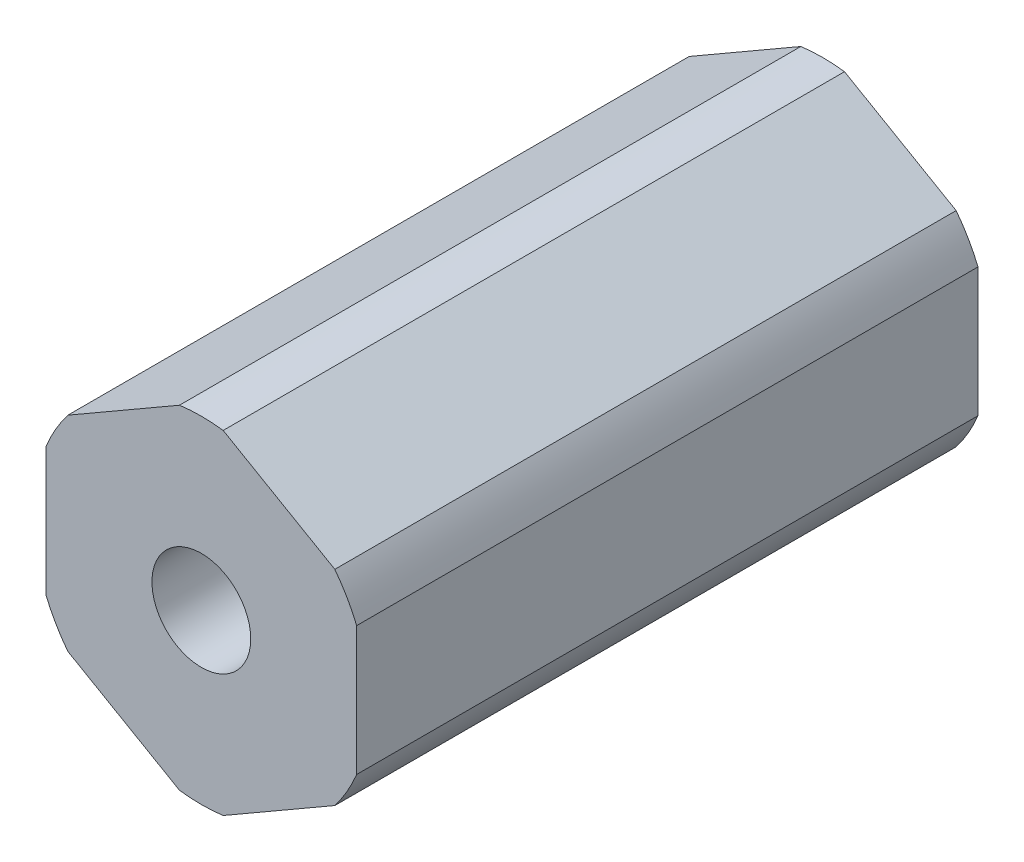
from build123d import *

# Parameters (mm, degrees)
SKETCH1_R                            = 2.0193
BOSS_EXTRUDE1_DEPTH                  = 25.4
F_10_32_TAPPED_HOLE1_D               = 4.0386
F_10_32_TAPPED_HOLE1_DEPTH           = 12.02944
F_10_32_TAPPED_HOLE1_TIP             = 1.213317848
F_10_32_TAPPED_HOLE1_ON_FACE_2_D     = 4.0386
F_10_32_TAPPED_HOLE1_ON_FACE_2_DEPTH = 12.02944
F_10_32_TAPPED_HOLE1_ON_FACE_2_TIP   = 1.213317848


with BuildPart() as part:
    # Sketch1 → Boss-Extrude1 (new body)
    with BuildSketch(Plane.XY):
        with BuildLine():
            ThreePointArc((0.893039571, 6.816751782), (0, 6.874999966), (-0.893039571, 6.816751782))
            Line((-0.893039571, 6.816751782), (-5.456960429, 4.181770846))
            ThreePointArc((-5.456960429, 4.181770846), (-5.953924622, 3.437499983), (-6.35, 2.634980936))
            Line((-6.35, 2.634980936), (-6.35, -2.634980936))
            ThreePointArc((-6.35, -2.634980936), (-5.953924622, -3.437499983), (-5.456960429, -4.181770846))
            Line((-5.456960429, -4.181770846), (-0.893039571, -6.816751782))
            ThreePointArc((-0.893039571, -6.816751782), (0, -6.874999966), (0.893039571, -6.816751782))
            Line((0.893039571, -6.816751782), (5.456960429, -4.181770846))
            ThreePointArc((5.456960429, -4.181770846), (5.953924622, -3.437499983), (6.35, -2.634980936))
            Line((6.35, -2.634980936), (6.35, 2.634980936))
            ThreePointArc((6.35, 2.634980936), (5.953924622, 3.437499983), (5.456960429, 4.181770846))
            Line((5.456960429, 4.181770846), (0.893039571, 6.816751782))
        make_face()
        Circle(SKETCH1_R, mode=Mode.SUBTRACT)
    extrude(amount=BOSS_EXTRUDE1_DEPTH)

    # #10-32 Tapped Hole1
    with Locations(Plane.XY.offset(25.4)):
        with Locations((0, 0)):
            Hole(F_10_32_TAPPED_HOLE1_D / 2, depth=F_10_32_TAPPED_HOLE1_DEPTH)
            with Locations((0, 0, -(F_10_32_TAPPED_HOLE1_DEPTH + F_10_32_TAPPED_HOLE1_TIP / 2))):  # 118° drill point
                Cone(0, F_10_32_TAPPED_HOLE1_D / 2, F_10_32_TAPPED_HOLE1_TIP, mode=Mode.SUBTRACT)

    # #10-32 Tapped Hole1 on face 2
    with Locations(Plane.XY):
        with Locations((0, 0)):
            Hole(F_10_32_TAPPED_HOLE1_ON_FACE_2_D / 2, depth=F_10_32_TAPPED_HOLE1_ON_FACE_2_DEPTH)
            with Locations((0, 0, -(F_10_32_TAPPED_HOLE1_ON_FACE_2_DEPTH + F_10_32_TAPPED_HOLE1_ON_FACE_2_TIP / 2))):  # 118° drill point
                Cone(0, F_10_32_TAPPED_HOLE1_ON_FACE_2_D / 2, F_10_32_TAPPED_HOLE1_ON_FACE_2_TIP, mode=Mode.SUBTRACT)


solid = part.part
